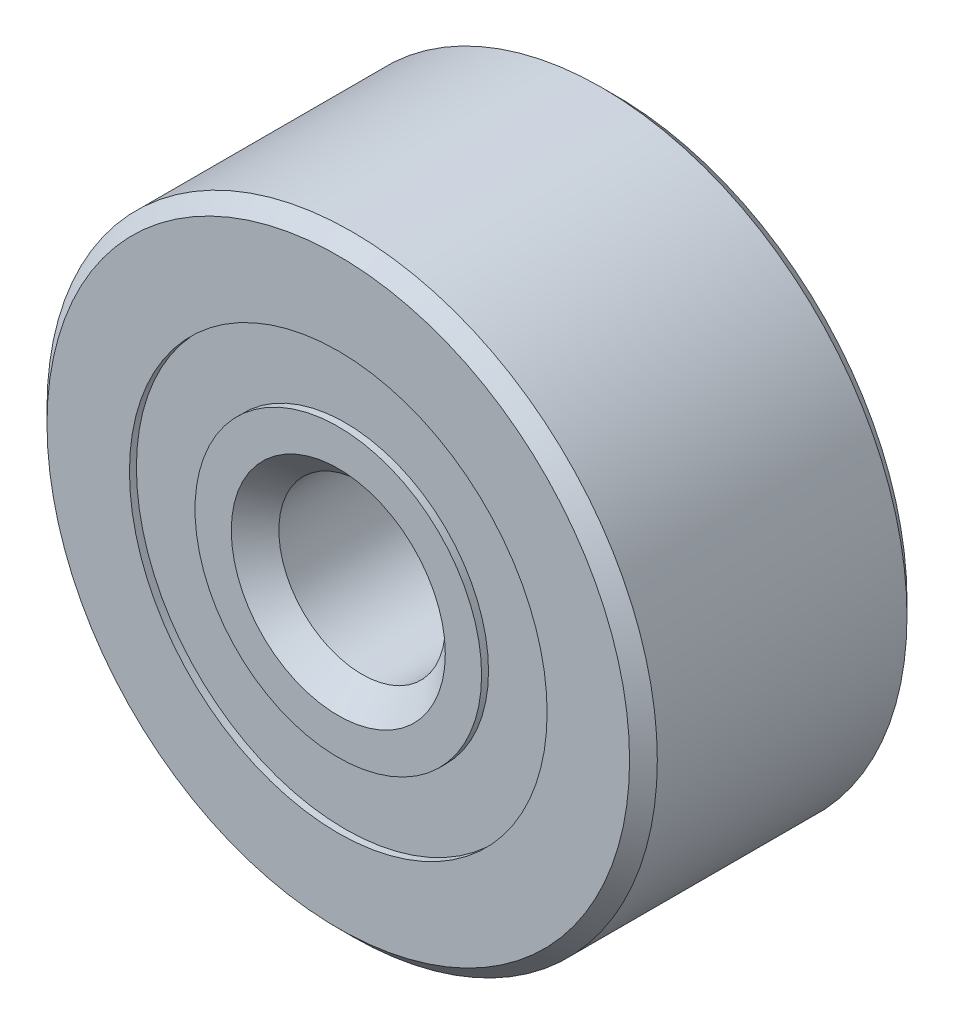
from build123d import *

# Parameters (mm, degrees)
CIRPATTERN1_COUNT = 8
SKETCH5_W         = 1.957414803
SKETCH5_H         = 1.874996403


with BuildPart() as part:
    # Sketch1 → Revolve1 (revolve)
    with BuildSketch(Plane(origin=(0, 0, 0), x_dir=(0, 0, -1), z_dir=(1, 0, 0))):
        with BuildLine():
            Line((3.571875, 8.73125), (-3.571875, 8.73125))
            Line((-3.571875, 8.73125), (-3.96875, 8.334375))
            Line((-3.96875, 8.334375), (-3.96875, 5.974931319))
            Line((-3.96875, 5.974931319), (-1.763888889, 5.974931319))
            ThreePointArc((-1.763888889, 5.974931319), (0, 7.369147697), (1.763888889, 5.974931319))
            Line((1.763888889, 5.974931319), (3.96875, 5.974931319))
            Line((3.96875, 5.974931319), (3.96875, 8.334375))
            Line((3.96875, 8.334375), (3.571875, 8.73125))
        make_face()
    revolve(axis=Axis((0, 0, 3.96875), (0, 0, -1)))


with BuildPart() as body_2:
    # Sketch3 → Revolve3 (revolve)
    with BuildSketch(Plane(origin=(0, 0, 0), x_dir=(0, 0, -1), z_dir=(1, 0, 0))):
        with BuildLine():
            Line((-3.7703125, 3.901497416), (-2.931116235, 3.062301152))
            Line((-2.931116235, 3.062301152), (0, 3.062301152))
            Line((0, 3.062301152), (0, 3.743352303))
            ThreePointArc((0, 3.743352303), (1.124182294, 4.133993965), (1.763888889, 5.137568681))
            Line((1.763888889, 5.137568681), (3.96875, 5.137568681))
            Line((3.96875, 5.137568681), (3.96875, 2.778125))
            Line((3.96875, 2.778125), (3.571875, 2.38125))
            Line((3.571875, 2.38125), (-3.287698848, 2.38125))
            Line((-3.287698848, 2.38125), (-3.96875, 3.062301152))
            Line((-3.96875, 3.062301152), (-3.96875, 4.099934916))
            Line((-3.96875, 4.099934916), (-3.7703125, 4.099934916))
            Line((-3.7703125, 4.099934916), (-3.7703125, 3.901497416))
        make_face()
    revolve(axis=Axis((0, 0, 3.96875), (0, 0, -1)))


with BuildPart() as body_3:
    # Sketch4 → Revolve4 (revolve)
    with BuildSketch(Plane(origin=(0, 0, 0), x_dir=(0, 0, -1), z_dir=(1, 0, 0))):
        with BuildLine():
            Line((-1.812897697, 5.55625), (1.812897697, 5.55625))
            ThreePointArc((1.812897697, 5.55625), (0, 7.369147697), (-1.812897697, 5.55625))
        make_face()
    revolve(axis=Axis((0, 5.55625, 1.812897697), (0, 0, -1)))


with BuildPart() as cirpattern1_1:
    # CirPattern1: pattern copy
    add(body_3.part.rotate(Axis((0, 0, -3.96875), (0, 0, 1)), 1 * 360 / CIRPATTERN1_COUNT))


with BuildPart() as cirpattern1_2:
    # CirPattern1: pattern copy
    add(body_3.part.rotate(Axis((0, 0, -3.96875), (0, 0, 1)), 2 * 360 / CIRPATTERN1_COUNT))


with BuildPart() as cirpattern1_3:
    # CirPattern1: pattern copy
    add(body_3.part.rotate(Axis((0, 0, -3.96875), (0, 0, 1)), 3 * 360 / CIRPATTERN1_COUNT))


with BuildPart() as cirpattern1_4:
    # CirPattern1: pattern copy
    add(body_3.part.rotate(Axis((0, 0, -3.96875), (0, 0, 1)), 4 * 360 / CIRPATTERN1_COUNT))


with BuildPart() as cirpattern1_5:
    # CirPattern1: pattern copy
    add(body_3.part.rotate(Axis((0, 0, -3.96875), (0, 0, 1)), 5 * 360 / CIRPATTERN1_COUNT))


with BuildPart() as cirpattern1_6:
    # CirPattern1: pattern copy
    add(body_3.part.rotate(Axis((0, 0, -3.96875), (0, 0, 1)), 6 * 360 / CIRPATTERN1_COUNT))


with BuildPart() as cirpattern1_7:
    # CirPattern1: pattern copy
    add(body_3.part.rotate(Axis((0, 0, -3.96875), (0, 0, 1)), 7 * 360 / CIRPATTERN1_COUNT))


with BuildPart() as body_11:
    # Sketch5 → Revolve5 (revolve)
    with BuildSketch(Plane(origin=(0, 0, 0), x_dir=(0, 0, -1), z_dir=(1, 0, 0))):
        with Locations((-2.791605099, 5.037433118)):
            Rectangle(SKETCH5_W, SKETCH5_H)
        with Locations((2.791605099, 5.037433118)):
            Rectangle(SKETCH5_W, SKETCH5_H)
    revolve(axis=Axis((0, 0, 3.96875), (0, 0, -1)))


solid = Compound([part.part, body_2.part, body_3.part, cirpattern1_1.part, cirpattern1_2.part, cirpattern1_3.part, cirpattern1_4.part, cirpattern1_5.part, cirpattern1_6.part, cirpattern1_7.part, body_11.part])
